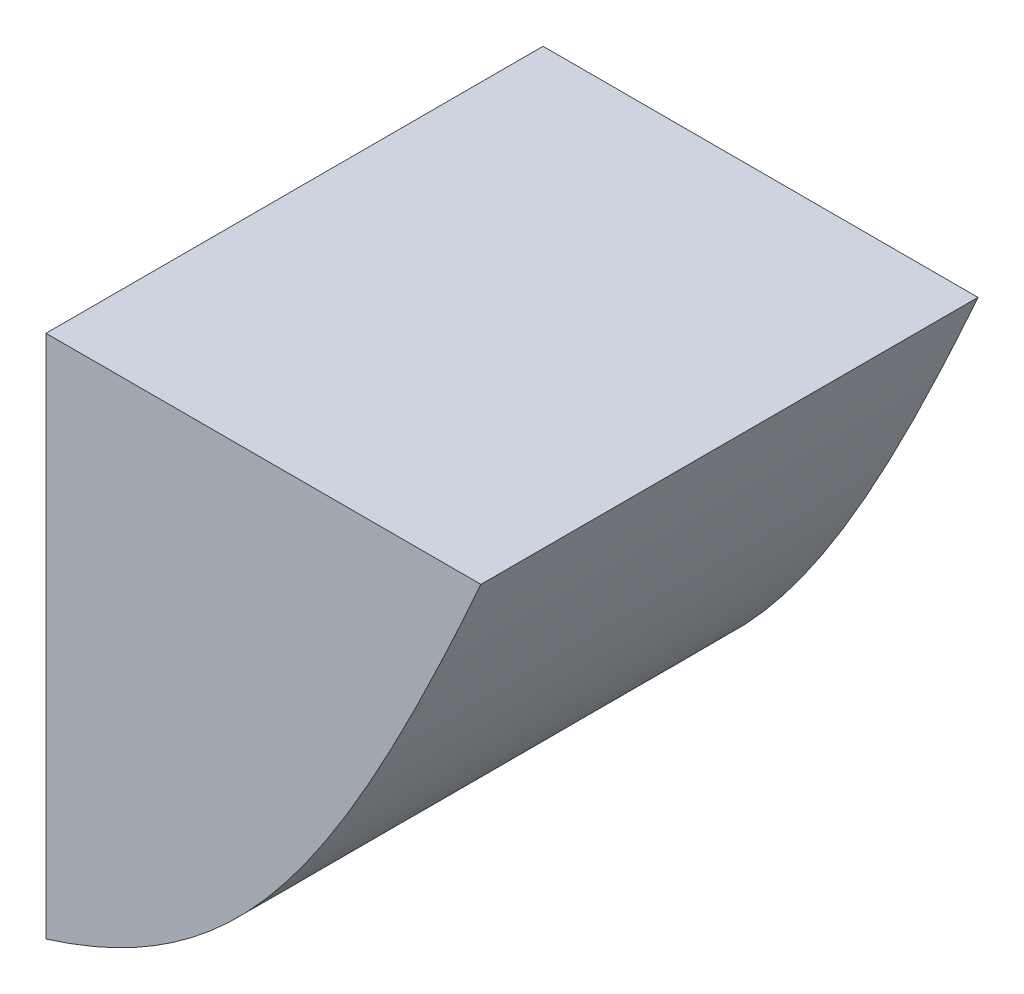
from build123d import *

# Parameters (mm, degrees)
FEATURE_PRISM_DEPTH = 8
PROFILE_CUT_W       = 7
PROFILE_CUT_H       = 13
FEATURE_TRIM_DEPTH  = 18.000000171


with BuildPart() as part:
    # profile:rational → feature:prism (new body)
    with BuildSketch(Plane.XY):
        with BuildLine():
            Line((12, 9), (0, 9))
            Line((0, 9), (0, 0))
            add(Edge.make_bspline(
                [(0, 0), (4, 0), (8, 0), (12, 9)],
                knots=[0, 0, 0, 0, 1, 1, 1, 1], degree=3, weights=[1, 0.75, 1.25, 1]))
        make_face()
    extrude(amount=FEATURE_PRISM_DEPTH)

    # profile:cut → feature:trim (cut, through all)
    with BuildSketch(Plane.XY):
        with Locations((1.5, 4.5)):
            Rectangle(PROFILE_CUT_W, PROFILE_CUT_H)
    extrude(amount=FEATURE_TRIM_DEPTH, mode=Mode.SUBTRACT)


solid = part.part
